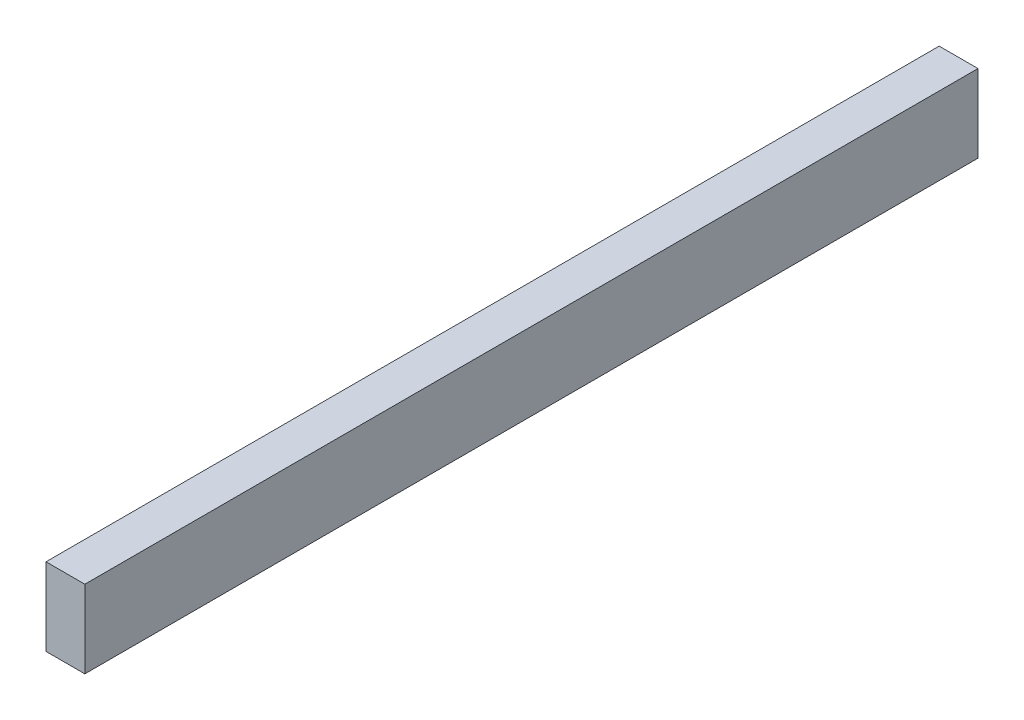
from build123d import *

# Parameters (mm, degrees)
SKETCH1_W           = 25.4
SKETCH1_H           = 50.8
BOSS_EXTRUDE1_DEPTH = 584.2


with BuildPart() as part:
    # Sketch1 → Boss-Extrude1 (new body)
    with BuildSketch(Plane.XY):
        Rectangle(SKETCH1_W, SKETCH1_H)
    extrude(amount=BOSS_EXTRUDE1_DEPTH)


solid = part.part
